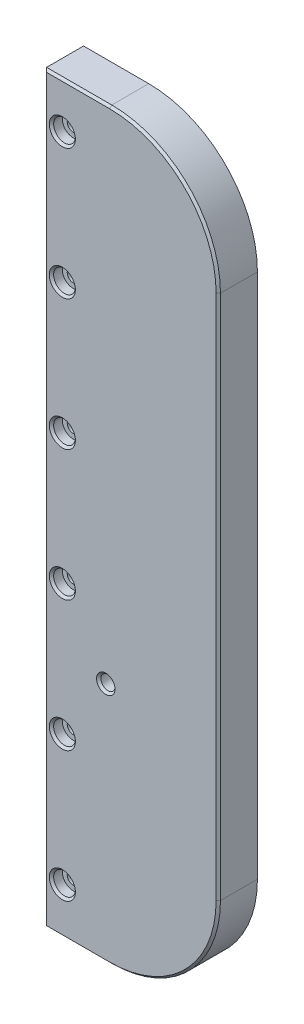
from build123d import *

# Parameters (mm, degrees)
SKETCH1_W                      = 80
SKETCH1_H                      = 342
BOSS_EXTRUDE1_DEPTH            = 18
FILLET1_R                      = 50
CBORE_FOR_M5_SHCS1_D           = 5.5
CBORE_FOR_M5_SHCS1_DEPTH       = 28.347633298
CBORE_FOR_M5_SHCS1_CBORE_D     = 10
CBORE_FOR_M5_SHCS1_CBORE_DEPTH = 5
CBORE_FOR_M5_SHCS1_TIP         = 1.652366702
CHAMFER1_SIZE                  = 1
SKETCH5_R                      = 3.25
CUT_EXTRUDE1_DEPTH             = 284.418418597
CHAMFER2_SIZE                  = 1


with BuildPart() as part:
    # Sketch1 → Boss-Extrude1 (new body)
    with BuildSketch(Plane.XY):
        with Locations((41, 100)):
            Rectangle(SKETCH1_W, SKETCH1_H)
    extrude(amount=BOSS_EXTRUDE1_DEPTH)

    # Fillet1
    fillet1_edges = [part.edges().sort_by_distance(p)[0] for p in [
        (81, 271, 9),
        (81, -71, 9),
    ]]
    fillet(fillet1_edges, radius=FILLET1_R)

    # CBORE for M5 SHCS1
    with Locations(Plane.XY.offset(18)):
        with Locations((9.25, 250), (9.25, 190), (9.25, 130), (9.25, 70), (9.25, 10), (9.25, -50)):
            CounterBoreHole(CBORE_FOR_M5_SHCS1_D / 2, CBORE_FOR_M5_SHCS1_CBORE_D / 2, CBORE_FOR_M5_SHCS1_CBORE_DEPTH, depth=CBORE_FOR_M5_SHCS1_DEPTH)
            with Locations((0, 0, -(CBORE_FOR_M5_SHCS1_DEPTH + CBORE_FOR_M5_SHCS1_TIP / 2))):  # 118° drill point
                Cone(0, CBORE_FOR_M5_SHCS1_D / 2, CBORE_FOR_M5_SHCS1_TIP, mode=Mode.SUBTRACT)

    # Chamfer1
    chamfer1_edges = [part.edges().sort_by_distance(p)[0] for p in [
        (16, 271, 18),
        (81, 100, 18),
        (66.355339059, -56.355339059, 18),
        (66.355339059, 256.355339059, 18),
        (4.25, -50, 18),
        (4.25, 10, 18),
        (4.25, 70, 18),
        (1, 100, 18),
        (4.25, 130, 18),
        (4.25, 190, 18),
        (4.25, 250, 18),
        (16, -71, 18),
    ]]
    chamfer(chamfer1_edges, length=CHAMFER1_SIZE)

    # Sketch5 → Cut-Extrude1 (cut, through all)
    with BuildSketch(Plane.XY.offset(18)):
        with Locations((29.25, 40)):
            Circle(SKETCH5_R)
    extrude(amount=-CUT_EXTRUDE1_DEPTH, mode=Mode.SUBTRACT)

    # Chamfer2
    chamfer2_edges = [part.edges().sort_by_distance(p)[0] for p in [
        (26, 40, 0),
        (26, 40, 18),
    ]]
    chamfer(chamfer2_edges, length=CHAMFER2_SIZE)


solid = part.part
